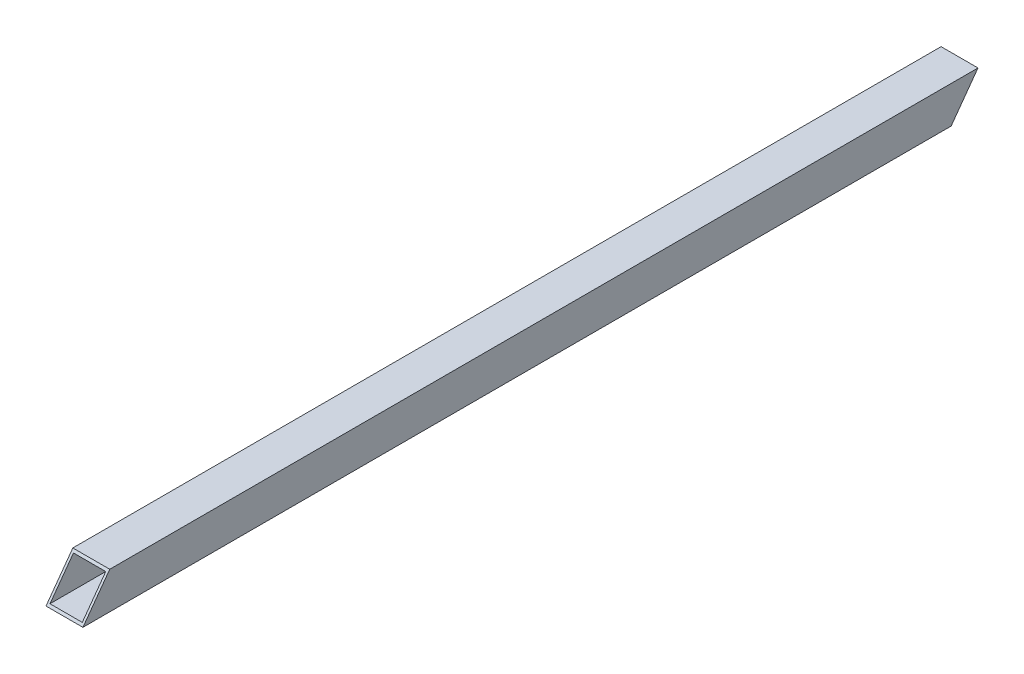
from build123d import *

# Parameters (mm, degrees)
SKETCH1_W           = 50.8
SKETCH1_H           = 50.8
SKETCH1_W_2         = 44.45
SKETCH1_H_2         = 44.45
BOSS_EXTRUDE1_DEPTH = 1231.9
CUT_EXTRUDE1_DEPTH  = 1234.20858333
CUT_EXTRUDE2_DEPTH  = 1234.20858333


with BuildPart() as part:
    # Sketch1 → Boss-Extrude1 (new body)
    with BuildSketch(Plane.XY):
        Rectangle(SKETCH1_W, SKETCH1_H)
        Rectangle(SKETCH1_W_2, SKETCH1_H_2, mode=Mode.SUBTRACT)
    extrude(amount=BOSS_EXTRUDE1_DEPTH)

    # Sketch2 → Cut-Extrude1 (cut, through all)
    with BuildSketch(Plane.ZY.offset(25.4)):
        Polygon((0, 25.4), (36.908360423, -25.4), (0, -25.4), align=None)
    extrude(amount=-CUT_EXTRUDE1_DEPTH, mode=Mode.SUBTRACT)

    # Sketch3 → Cut-Extrude2 (cut, through all)
    with BuildSketch(Plane.ZY.offset(25.4)):
        Polygon((1231.9, -25.4), (1194.991639577, 25.4), (1231.9, 25.4), align=None)
    extrude(amount=-CUT_EXTRUDE2_DEPTH, mode=Mode.SUBTRACT)


solid = part.part
